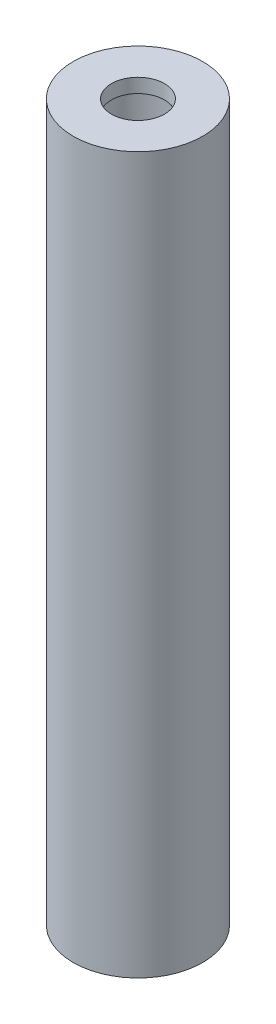
from build123d import *

# Parameters (mm, degrees)
SKETCH1_R           = 2.9083
SKETCH1_R_2         = 1.524
BOSS_EXTRUDE1_DEPTH = 32.131
BOSS_EXTRUDE5_START = -0.635
SKETCH7_R           = 1.524
SKETCH7_R_2         = 1.190625
BOSS_EXTRUDE5_DEPTH = 0.635
SKETCH8_R           = 1.7859375
CUT_EXTRUDE2_DEPTH  = 3.175


with BuildPart() as part:
    # Sketch1 → Boss-Extrude1 (new body)
    with BuildSketch(Plane(origin=(0, 0, 0), x_dir=(1, 0, 0), z_dir=(0, 1, 0))):
        with Locations(Location((0, 0, 0), (0, 0, 270))):
            Circle(SKETCH1_R)
        with Locations(Location((0, 0, 0), (0, 0, 270))):
            Circle(SKETCH1_R_2, mode=Mode.SUBTRACT)
    extrude(amount=BOSS_EXTRUDE1_DEPTH)

    # Sketch7 → Boss-Extrude5 (add)
    with BuildSketch(Plane(origin=(0, 32.131, 0), x_dir=(1, 0, 0), z_dir=(0, 1, 0)).offset(BOSS_EXTRUDE5_START)):
        with Locations(Location((0, 0, 0), (0, 0, 270))):
            Circle(SKETCH7_R)
        with Locations(Location((0, 0, 0), (0, 0, 270))):
            Circle(SKETCH7_R_2, mode=Mode.SUBTRACT)
    extrude(amount=BOSS_EXTRUDE5_DEPTH)

    # Sketch8 → Cut-Extrude2 (cut)
    with BuildSketch(Plane(origin=(0, 31.496, 0), x_dir=(1, 0, 0), z_dir=(0, 1, 0))):
        with Locations(Location((0, 0, 0), (0, 0, 270))):
            Circle(SKETCH8_R)
    extrude(amount=-CUT_EXTRUDE2_DEPTH, mode=Mode.SUBTRACT)


solid = part.part
